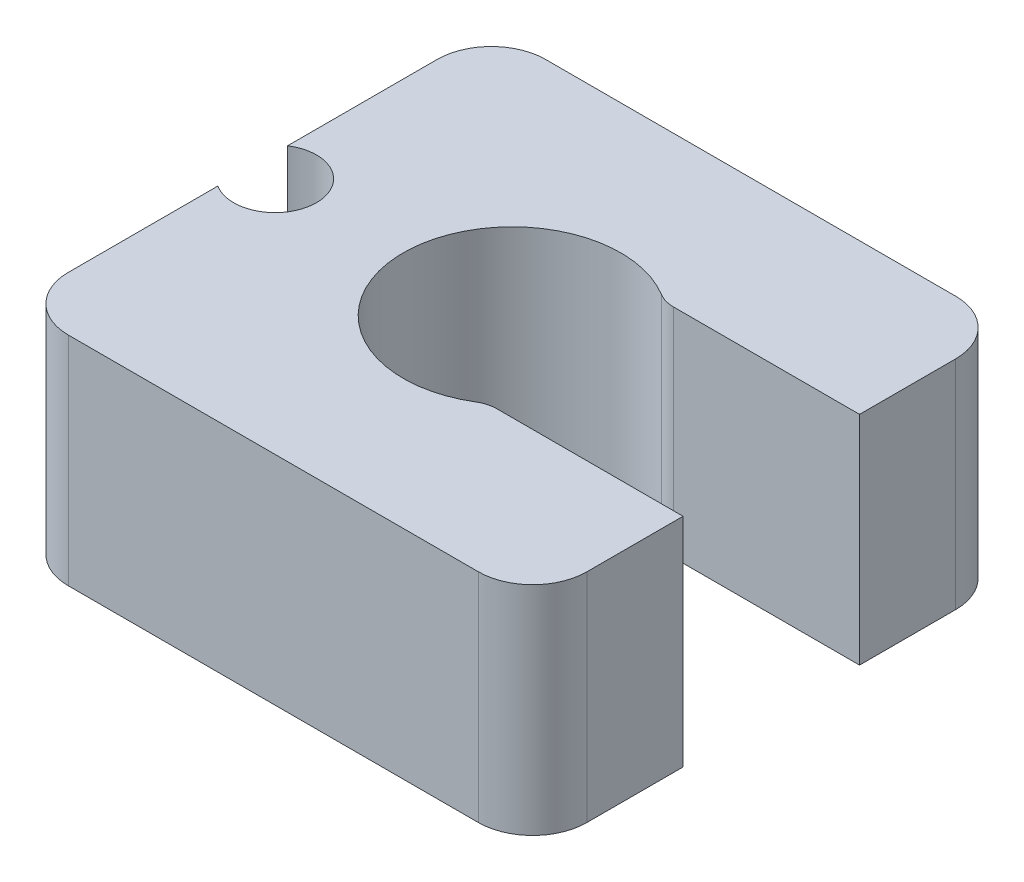
from build123d import *

# Parameters (mm, degrees)
SKETCH_4_R          = 1.001902262
EXTRUDE_2_DEPTH     = 2
CUT_EXTRUDE_START   = -2
CUT_EXTRUDE_3_DEPTH = 2
FILLET_1_R          = 0.5
FILLET_2_R          = 0.5
FILLET_3_R          = 0.3
CUT_EXTRUDE_4_DEPTH = 2
FILLET_4_R          = 0.3


with BuildPart() as part:
    # 草圖4 → 填料-伸長2 (new body)
    with BuildSketch(Plane(origin=(0, 0, 0), x_dir=(1, 0, 0), z_dir=(0, 1, 0))):
        with BuildLine():
            Line((2.387720447, 2.197754837), (-2.387720447, 2.197754837))
            Line((-2.387720447, 2.197754837), (-2.387720447, 0.321257975))
            ThreePointArc((-2.387720447, 0.321257975), (-1.998855162, 0.334704624), (-1.800436823, 0))
            ThreePointArc((-1.800436823, 0), (-1.998855162, -0.334704624), (-2.387720447, -0.321257975))
            Line((-2.387720447, -0.321257975), (-2.387720447, -2.197754837))
            Line((-2.387720447, -2.197754837), (2.387720447, -2.197754837))
            Line((2.387720447, -2.197754837), (2.387720447, 2.197754837))
        make_face()
        with Locations(Location((0, 0, 0), (0, 0, 270))):
            Circle(SKETCH_4_R, mode=Mode.SUBTRACT)
    extrude(amount=EXTRUDE_2_DEPTH)

    # 草圖5 → 除料-伸長3 (cut)
    with BuildSketch(Plane(origin=(0, 2, 0), x_dir=(1, 0, 0), z_dir=(0, 1, 0)).offset(CUT_EXTRUDE_START)):
        with BuildLine():
            ThreePointArc((0.834454153, 0.554521785), (0.959127116, 0.289626172), (1.001902262, 0))
            Line((1.001902262, 0), (2.387720447, 0))
            Line((2.387720447, 0), (2.387720447, 0.554521785))
            Line((2.387720447, 0.554521785), (0.834454153, 0.554521785))
        make_face()
        with BuildLine():
            Line((2.387720447, 0), (1.001902262, 0))
            ThreePointArc((1.001902262, 0), (0.959127116, -0.289626172), (0.834454153, -0.554521785))
            Line((0.834454153, -0.554521785), (2.387720447, -0.554521785))
            Line((2.387720447, -0.554521785), (2.387720447, 0))
        make_face()
    extrude(amount=CUT_EXTRUDE_3_DEPTH, mode=Mode.SUBTRACT)

    # 圓角1
    fillet_1_edges = [part.edges().sort_by_distance(p)[0] for p in [
        (2.387720447, 1, -2.197754837),
    ]]
    fillet(fillet_1_edges, radius=FILLET_1_R)

    # 圓角2
    fillet_2_edges = [part.edges().sort_by_distance(p)[0] for p in [
        (-2.387720447, 1, -2.197754837),
        (2.387720447, 1, 2.197754837),
        (-2.387720447, 1, 2.197754837),
    ]]
    fillet(fillet_2_edges, radius=FILLET_2_R)

    # 圓角3
    fillet_3_edges = [part.edges().sort_by_distance(p)[0] for p in [
        (0.834454153, 1, -0.554521785),
        (0.834454153, 1, 0.554521785),
    ]]
    fillet(fillet_3_edges, radius=FILLET_3_R)

    # 草圖6 → 除料-伸長4 (cut)
    with BuildSketch(Plane(origin=(0, 2, 0), x_dir=(1, 0, 0), z_dir=(0, 1, 0))):
        Polygon((0, 0), (0, -0.812711822), (2.387720447, -0.812711822), (2.387720447, 0.812711822), (0, 0.812711822), align=None)
    extrude(amount=-CUT_EXTRUDE_4_DEPTH, mode=Mode.SUBTRACT)

    # 圓角4
    fillet_4_edges = [part.edges().sort_by_distance(p)[0] for p in [
        (0.585924601, 1, -0.812711822),
        (0.585924601, 1, 0.812711822),
    ]]
    fillet(fillet_4_edges, radius=FILLET_4_R)


solid = part.part
